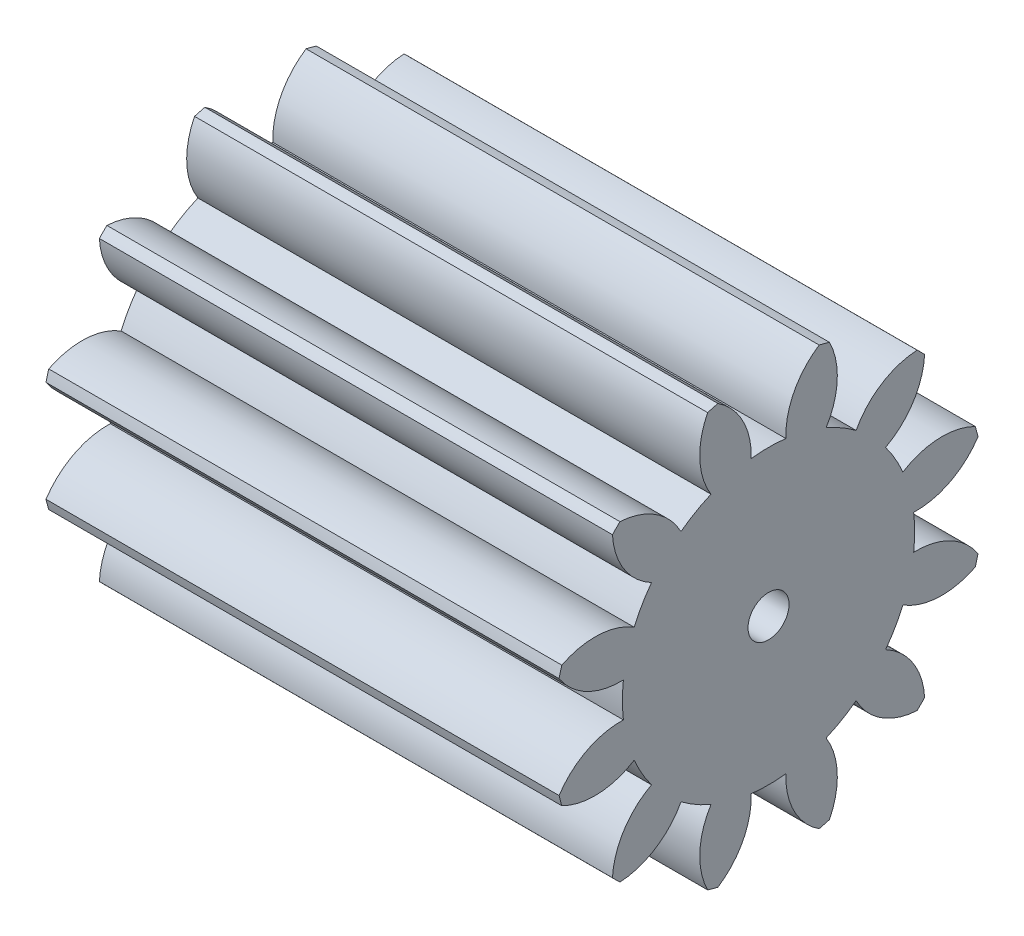
from build123d import *

# Parameters (mm, degrees)
BASPROSKE_W     = 10
BASPROSKE_H     = 4.2
TOOTHCUT_DEPTH  = 12.630993079
TEETHCUTS_COUNT = 12
TEETHCUTS_ANGLE = 330
BORSKE_R        = 0.4
BORE_DEPTH      = 50.0000508


with BuildPart() as part:
    # BasProSke → Base-Revolve (revolve)
    with BuildSketch(Plane(origin=(0, 0, 0), x_dir=(1, 0, 0), z_dir=(0, 1, 0)), mode=Mode.PRIVATE) as base_revolve_sk:
        with Locations((5, 2.1)):
            Rectangle(BASPROSKE_W, BASPROSKE_H)
    revolve(base_revolve_sk.sketch.rotate(Axis((-10, 0, 0), (1, 0, 0)), 180), axis=Axis((-10, 0, 0), (1, 0, 0)))

    # TooCutSke → ToothCut (cut, through all)
    with BuildSketch(Plane(origin=(0, 0, 0), x_dir=(0, 0, -1), z_dir=(1, 0, 0))):
        with BuildLine():
            ThreePointArc((0.337615381, 2.828925035), (0, 2.849), (-0.337615381, 2.828925035))
            ThreePointArc((-0.337615381, 2.828925035), (-0.506076789, 3.556215713), (-1.016063844, 4.101416758))
            ThreePointArc((-1.016063844, 4.101416758), (0, 4.2254), (1.016063844, 4.101416758))
            ThreePointArc((1.016063844, 4.101416758), (0.506076789, 3.556215713), (0.337615381, 2.828925035))
        make_face()
    toothcut = extrude(amount=TOOTHCUT_DEPTH, mode=Mode.SUBTRACT)

    # TeethCuts: ToothCut ×12 about axis
    teethcuts_axis = Axis((-10, 0, 0), (1, 0, 0))
    for i in range(1, TEETHCUTS_COUNT):
        add(toothcut.rotate(teethcuts_axis, i * TEETHCUTS_ANGLE / (TEETHCUTS_COUNT - 1)), mode=Mode.SUBTRACT)

    # BorSke → Bore (cut, symmetric)
    with BuildSketch(Plane(origin=(0, 0, 0), x_dir=(0, 0, -1), z_dir=(1, 0, 0))):
        with Locations(Location((0, 0, 0), (0, 0, 180))):
            Circle(BORSKE_R)
    extrude(amount=BORE_DEPTH, both=True, mode=Mode.SUBTRACT)


solid = part.part
